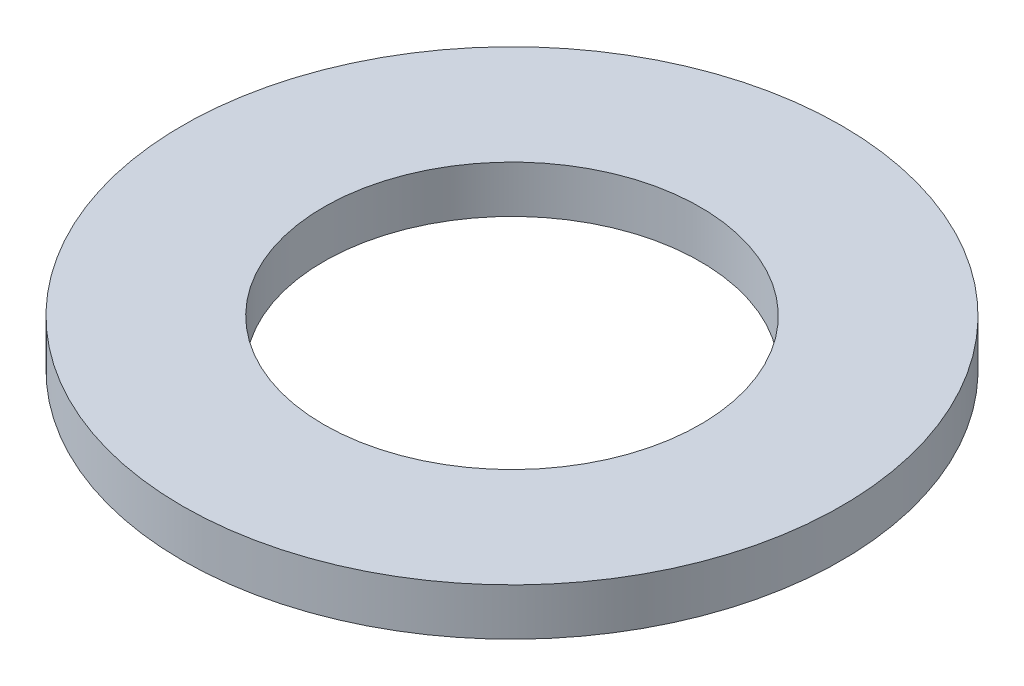
from build123d import *

# Parameters (mm, degrees)
SKETCH1_R           = 7
BOSS_EXTRUDE1_DEPTH = 1
SKETCH5_R           = 4
CUT_EXTRUDE1_DEPTH  = 10.949874371


with BuildPart() as part:
    # Sketch1 → Boss-Extrude1 (new body)
    with BuildSketch(Plane(origin=(0, 0, 0), x_dir=(1, 0, 0), z_dir=(0, 1, 0))):
        with Locations(Location((0, 0, 0), (0, 0, 270))):
            Circle(SKETCH1_R)
    extrude(amount=BOSS_EXTRUDE1_DEPTH)

    # Sketch5 → Cut-Extrude1 (cut, through all)
    with BuildSketch(Plane(origin=(0, 1, 0), x_dir=(-1, 0, 0), z_dir=(0, 1, 0))):
        with Locations(Location((0, 0, 0), (0, 0, 90))):
            Circle(SKETCH5_R)
    extrude(amount=-CUT_EXTRUDE1_DEPTH, mode=Mode.SUBTRACT)


solid = part.part
